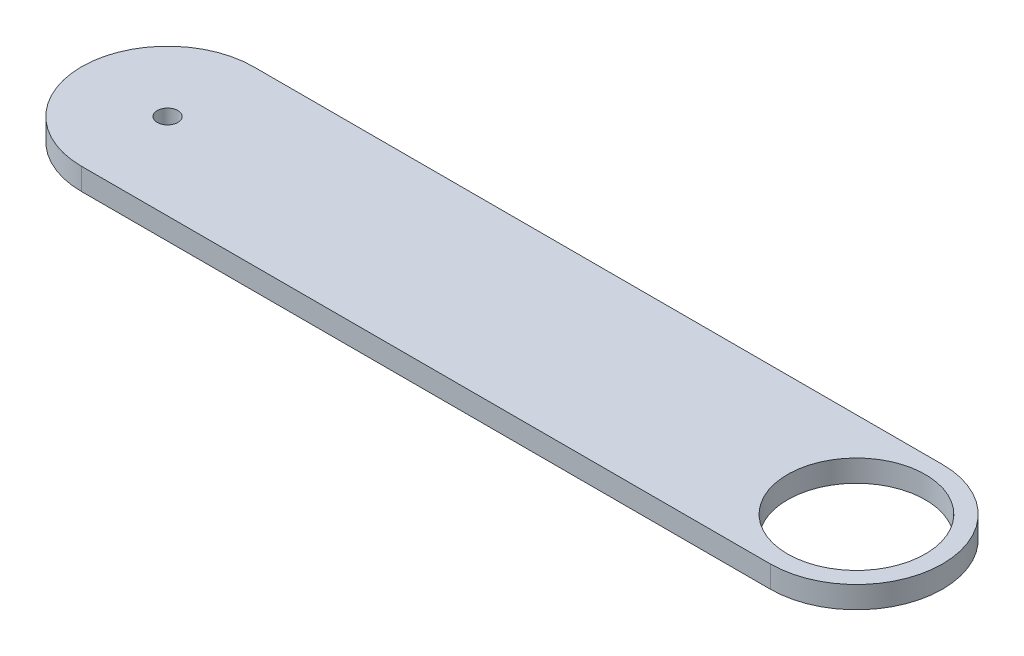
from build123d import *

# Parameters (mm, degrees)
BOSS_EXTRUDE1_DEPTH = 3.18
SKETCH2_R           = 1.5
SKETCH2_R_2         = 10
CUT_EXTRUDE1_DEPTH  = 3.18


with BuildPart() as part:
    # Sketch1 → Boss-Extrude1 (new body)
    with BuildSketch(Plane(origin=(0, 0, 0), x_dir=(1, 0, 0), z_dir=(0, 1, 0))):
        with BuildLine():
            Line((0, 0), (100, 0))
            ThreePointArc((100, 0), (112.5, -12.5), (100, -25))
            Line((100, -25), (0, -25))
            ThreePointArc((0, -25), (-12.5, -12.5), (0, 0))
        make_face()
    extrude(amount=BOSS_EXTRUDE1_DEPTH)

    # Sketch2 → Cut-Extrude1 (cut)
    with BuildSketch(Plane(origin=(0, 3.18, 0), x_dir=(1, 0, 0), z_dir=(0, 1, 0))):
        with Locations(Location((0, -12.5, 0), (0, 0, 270))):
            Circle(SKETCH2_R)
        with Locations(Location((100, -12.5, 0), (0, 0, 270))):
            Circle(SKETCH2_R_2)
    extrude(amount=-CUT_EXTRUDE1_DEPTH, mode=Mode.SUBTRACT)


solid = part.part
